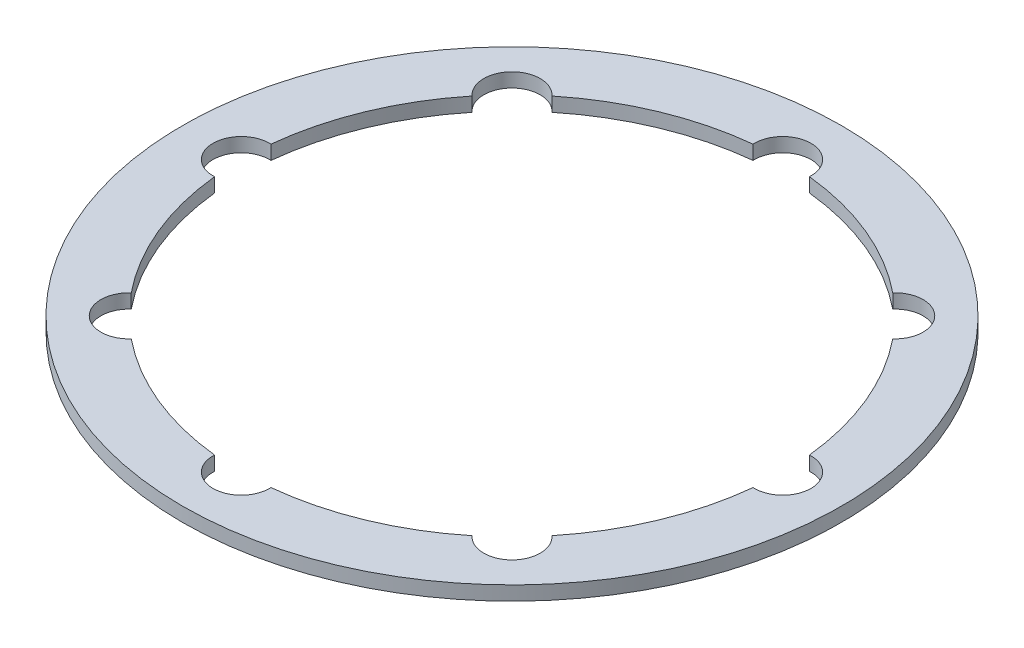
from build123d import *

# Parameters (mm, degrees)
SKETCH_1_R      = 70
EXTRUDE_1_DEPTH = 3


with BuildPart() as part:
    # Эскиз1 → Бобышка-Вытянуть1 (new body)
    with BuildSketch(Plane(origin=(0, 0, 0), x_dir=(1, 0, 0), z_dir=(0, 1, 0))):
        with Locations(Location((0, 0, 0), (0, 0, 90))):
            Circle(SKETCH_1_R)
        with BuildLine():
            ThreePointArc((-5.991828083, 57.186956522), (-22.004297361, 53.123073119), (-36.200422482, 44.674147021))
            ThreePointArc((-36.200422482, 44.674147021), (-44.901280605, 44.901280605), (-44.674147021, 36.200422482))
            ThreePointArc((-44.674147021, 36.200422482), (-53.123073119, 22.004297361), (-57.186956522, 5.991828083))
            ThreePointArc((-57.186956522, 5.991828083), (-63.5, 0), (-57.186956522, -5.991828083))
            ThreePointArc((-57.186956522, -5.991828083), (-53.123073119, -22.004297361), (-44.674147021, -36.200422482))
            ThreePointArc((-44.674147021, -36.200422482), (-44.901280605, -44.901280605), (-36.200422482, -44.674147021))
            ThreePointArc((-36.200422482, -44.674147021), (-22.004297361, -53.123073119), (-5.991828083, -57.186956522))
            ThreePointArc((-5.991828083, -57.186956522), (0, -63.5), (5.991828083, -57.186956522))
            ThreePointArc((5.991828083, -57.186956522), (22.004297361, -53.123073119), (36.200422482, -44.674147021))
            ThreePointArc((36.200422482, -44.674147021), (44.901280605, -44.901280605), (44.674147021, -36.200422482))
            ThreePointArc((44.674147021, -36.200422482), (53.123073119, -22.004297361), (57.186956522, -5.991828083))
            ThreePointArc((57.186956522, -5.991828083), (63.5, 0), (57.186956522, 5.991828083))
            ThreePointArc((57.186956522, 5.991828083), (53.123073119, 22.004297361), (44.674147021, 36.200422482))
            ThreePointArc((44.674147021, 36.200422482), (44.901280605, 44.901280605), (36.200422482, 44.674147021))
            ThreePointArc((36.200422482, 44.674147021), (22.004297361, 53.123073119), (5.991828083, 57.186956522))
            ThreePointArc((5.991828083, 57.186956522), (0, 63.5), (-5.991828083, 57.186956522))
        make_face(mode=Mode.SUBTRACT)
    extrude(amount=EXTRUDE_1_DEPTH)


solid = part.part
